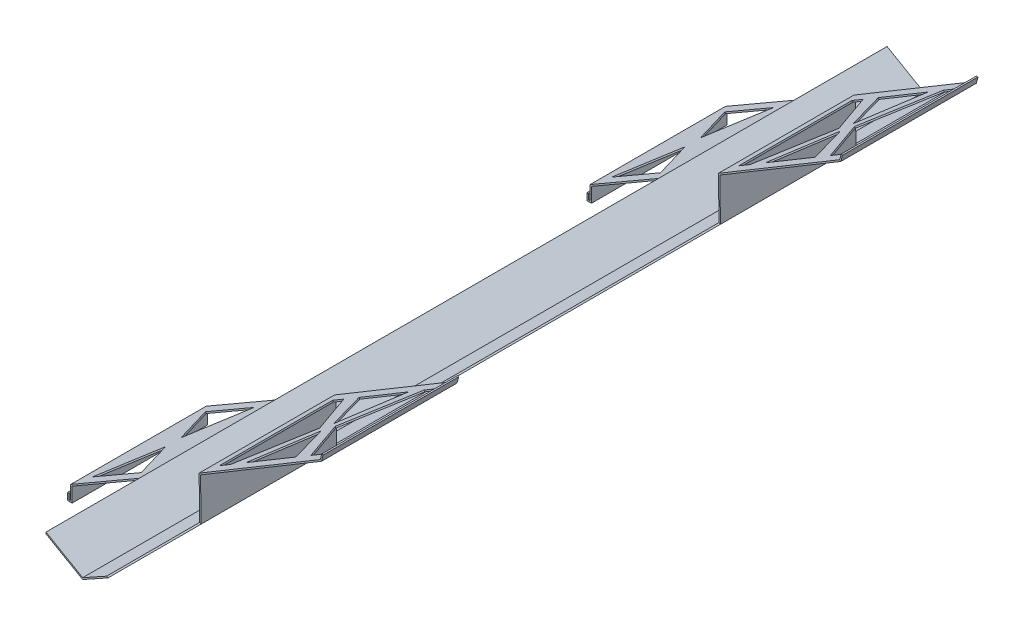
from build123d import *

# Parameters (mm, degrees)
BOSS_EXTRUDE1_DEPTH      = 480
BOSS_EXTRUDE2_DEPTH      = 1360
BOSS_EXTRUDE2_DEPTH_BACK = 810
BOSS_EXTRUDE3_DEPTH      = 480
BOSS_EXTRUDE4_DEPTH      = 330
CUT_EXTRUDE1_DEPTH       = 10
CUT_EXTRUDE1_DEPTH_BACK  = 30


with BuildPart() as part:
    # Sketch1 → Boss-Extrude1 (new body)
    with BuildSketch(Plane.XY):
        Polygon((11, 5), (11, 55), (253.48711306, 195), (383.390923627, 120), (468.131254081, 167.057169747), (465.927689259, 317.040983214), (895.221056619, 573.375149374), (900.737119771, 593.40706864), (905.633033208, 592.392159546), (899.716918706, 570.236137585), (470.969557333, 314.227995539), (473.174672886, 164.138632802), (383.342980003, 114.254177572), (253.48711306, 189.226497308), (16, 52.113248654), (16, 0), (0, 0), (0, 25), (5, 25), (5, 5), align=None)
    extrude(amount=BOSS_EXTRUDE1_DEPTH)

    # Sketch3 → Boss-Extrude2 (add, two sides: drawn at the far end of the back side and taken through both)
    with BuildSketch(Plane.XY.offset(480).offset(-BOSS_EXTRUDE2_DEPTH_BACK)):
        Polygon((253.48711306, 195), (383.390923627, 120), (468.131254081, 167.057169747), (473.174672886, 164.138632802), (383.342980003, 114.254177572), (253.48711306, 189.226497308), align=None)
    extrude(amount=BOSS_EXTRUDE2_DEPTH + BOSS_EXTRUDE2_DEPTH_BACK)

    # Sketch4 → Boss-Extrude3 (add)
    with BuildSketch(Plane.XY.offset(1840)):
        Polygon((0, 25), (5, 25), (5, 5), (11, 5), (11, 55), (253.48711306, 195), (383.390923627, 120), (468.131254081, 167.057169747), (465.927689259, 317.040983214), (895.221056619, 573.375149374), (900.737119771, 593.40706864), (905.633033208, 592.392159546), (899.716918706, 570.236137585), (470.969557333, 314.227995539), (473.174672886, 164.138632802), (383.342980003, 114.254177572), (253.48711306, 189.226497308), (16, 52.113248654), (16, 0), (0, 0), align=None)
    extrude(amount=BOSS_EXTRUDE3_DEPTH)

    # Sketch5 → Boss-Extrude4 (add)
    with BuildSketch(Plane.XY.offset(2320)):
        Polygon((253.48711306, 195), (383.390923627, 120), (468.131254081, 167.057169747), (473.174672886, 164.138632802), (383.342980003, 114.254177572), (253.48711306, 189.226497308), align=None)
    extrude(amount=BOSS_EXTRUDE4_DEPTH)

    # Sketch8 → Cut-Extrude1 (cut, two sides: drawn at the far end of the back side and taken through both)
    with BuildSketch(Plane(origin=(-17.092778033, 28.625978149, 0), x_dir=(0.8585867347200433, 0.5126683323190285, 0), z_dir=(-0.5126683323190286, 0.8585867347200434, 0)).offset(-CUT_EXTRUDE1_DEPTH_BACK)):
        Polygon((710.063615933, -40), (915.088795023, -40), (812.576205478, -217.557013508), align=None)
        Polygon((780.560416253, -240), (647.105417063, -39.497463328), (600.455591152, -39.497463328), (600.455591152, -440.502536672), (647.105417063, -440.502536672), align=None)
        Polygon((844.591994703, -240), (978.046993893, -39.497463328), (1024.696819804, -39.497463328), (1024.696819804, -440.502536672), (978.046993893, -440.502536672), align=None)
        Polygon((812.576205478, -262.442986492), (915.088795023, -440), (710.063615933, -440), align=None)
        Polygon((80.557501261, -440), (279.934557694, -440), (180.246029478, -267.334404198), align=None)
        Polygon((80.557501261, -40), (279.934557694, -40), (180.246029478, -212.665595802), align=None)
        Polygon((710.063615933, -1880), (915.088795023, -1880), (812.576205478, -2057.557013508), align=None)
        Polygon((978.046993893, -1879.497463328), (1024.696819804, -1879.497463328), (1024.696819804, -2280.502536672), (978.046993893, -2280.502536672), (844.591994703, -2080), align=None)
        Polygon((812.576205478, -2102.442986492), (915.088795023, -2280), (710.063615933, -2280), align=None)
        Polygon((780.560416253, -2080), (647.105417063, -1879.497463328), (600.455591152, -1879.497463328), (600.455591152, -2280.502536672), (647.105417063, -2280.502536672), align=None)
        Polygon((80.557501261, -1880), (279.934557694, -1880), (180.246029478, -2052.665595802), align=None)
        Polygon((279.934557694, -2280), (180.246029478, -2107.334404198), (80.557501261, -2280), align=None)
    extrude(amount=CUT_EXTRUDE1_DEPTH + CUT_EXTRUDE1_DEPTH_BACK, mode=Mode.SUBTRACT)


solid = part.part
